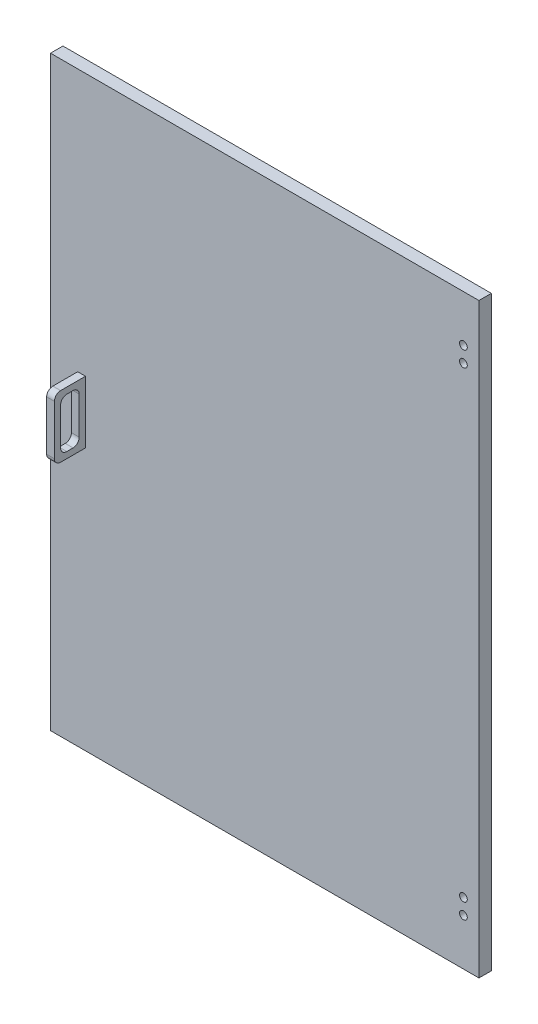
from build123d import *

# Parameters (mm, degrees)
SKETCH1_W           = 175.26
SKETCH1_H           = 240.03
BOSS_EXTRUDE1_DEPTH = 5.08
SKETCH2_R           = 1.5875
CUT_EXTRUDE1_DEPTH  = 149.689016155
SKETCH3_W           = 3.175
SKETCH3_H           = 25.4
BOSS_EXTRUDE2_DEPTH = 12.7
SKETCH4_W           = 7.62
SKETCH4_H           = 20.32
CUT_EXTRUDE2_DEPTH  = 202.189055322
FILLET1_R           = 2.54


with BuildPart() as part:
    # Sketch1 → Boss-Extrude1 (new body)
    with BuildSketch(Plane.XY):
        Rectangle(SKETCH1_W, SKETCH1_H)
    extrude(amount=-BOSS_EXTRUDE1_DEPTH)

    # Sketch2 → Cut-Extrude1 (cut, through all)
    with BuildSketch(Plane.XY):
        with Locations((81.28, 100.965)):
            Circle(SKETCH2_R)
        with Locations((81.28, 94.615)):
            Circle(SKETCH2_R)
        with Locations(Location((81.28, -94.615, 0), (0, 0, 180))):
            Circle(SKETCH2_R)
        with Locations(Location((81.28, -100.965, 0), (0, 0, 180))):
            Circle(SKETCH2_R)
    extrude(amount=-CUT_EXTRUDE1_DEPTH, mode=Mode.SUBTRACT)

    # Sketch3 → Boss-Extrude2 (add)
    with BuildSketch(Plane.XY):
        with Locations((-74.93, 0)):
            Rectangle(SKETCH3_W, SKETCH3_H)
    extrude(amount=BOSS_EXTRUDE2_DEPTH)

    # Sketch4 → Cut-Extrude2 (cut, through all)
    with BuildSketch(Plane(origin=(-73.3425, 0, 0), x_dir=(0, 0, -1), z_dir=(1, 0, 0))):
        with Locations((-6.35, 0)):
            Rectangle(SKETCH4_W, SKETCH4_H)
    extrude(amount=-CUT_EXTRUDE2_DEPTH, mode=Mode.SUBTRACT)

    # Fillet1
    fillet1_edges = [part.edges().sort_by_distance(p)[0] for p in [
        (-74.93, 12.7, 12.7),
        (-74.93, -12.7, 12.7),
        (-74.93, 10.16, 2.54),
        (-74.93, -10.16, 2.54),
        (-74.93, -10.16, 10.16),
        (-74.93, 10.16, 10.16),
    ]]
    fillet(fillet1_edges, radius=FILLET1_R)


solid = part.part
